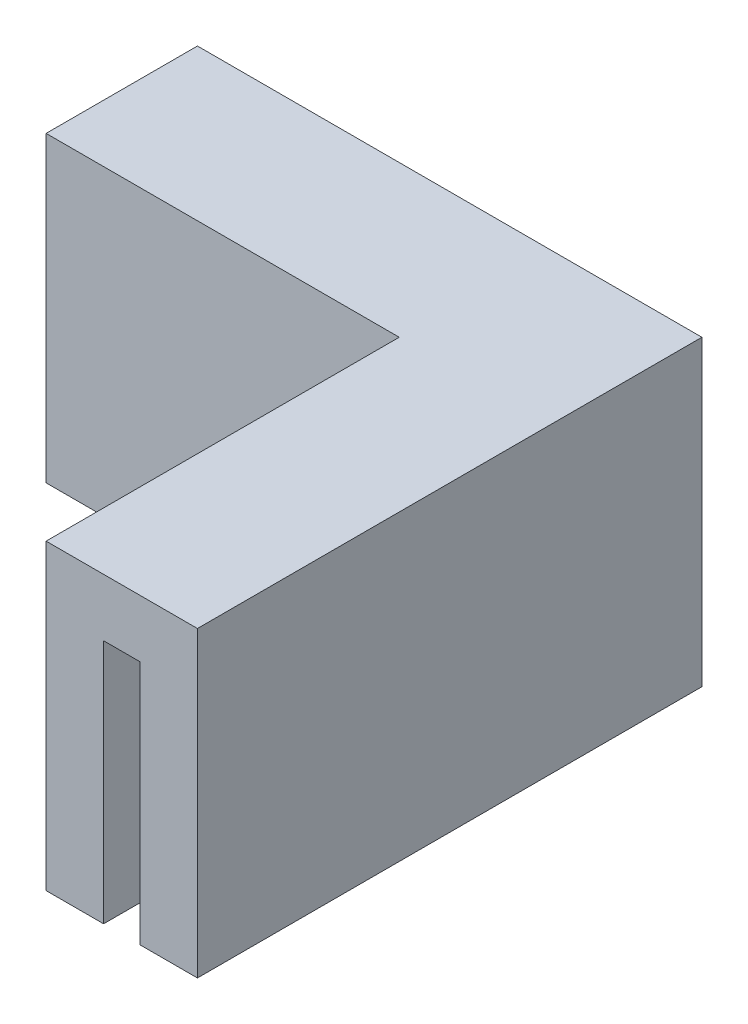
from build123d import *

# Parameters (mm, degrees)
BOSS_EXTRU_1_DEPTH      = 30
ENL_V_MAT_EXTRU_1_DEPTH = 24.3
ESQUISSE5_W             = 3.7
ESQUISSE5_H             = 3.7
BOSS_EXTRU_5_DEPTH      = 24.3


with BuildPart() as part:
    # Esquisse1 → Boss.-Extru.1 (new body)
    with BuildSketch(Plane(origin=(0, 0, 0), x_dir=(1, 0, 0), z_dir=(0, 1, 0))):
        Polygon((0, 0), (0, -15), (35, -15), (35, -50), (50, -50), (50, 0), align=None)
    extrude(amount=BOSS_EXTRU_1_DEPTH)

    # Esquisse2 → Enlèv. mat.-Extru.1 (cut)
    with BuildSketch(Plane.XZ):
        Polygon((40.7, 50), (40.7, 9.3), (0, 9.3), (0, 5.7), (44.3, 5.7), (44.3, 50), align=None)
    extrude(amount=-ENL_V_MAT_EXTRU_1_DEPTH, mode=Mode.SUBTRACT)

    # Esquisse5 → Boss.-Extru.5 (add)
    with BuildSketch(Plane.XZ.offset(-24.3)):
        with Locations((42.45, 7.55)):
            Rectangle(ESQUISSE5_W, ESQUISSE5_H)
    extrude(amount=BOSS_EXTRU_5_DEPTH)


solid = part.part
